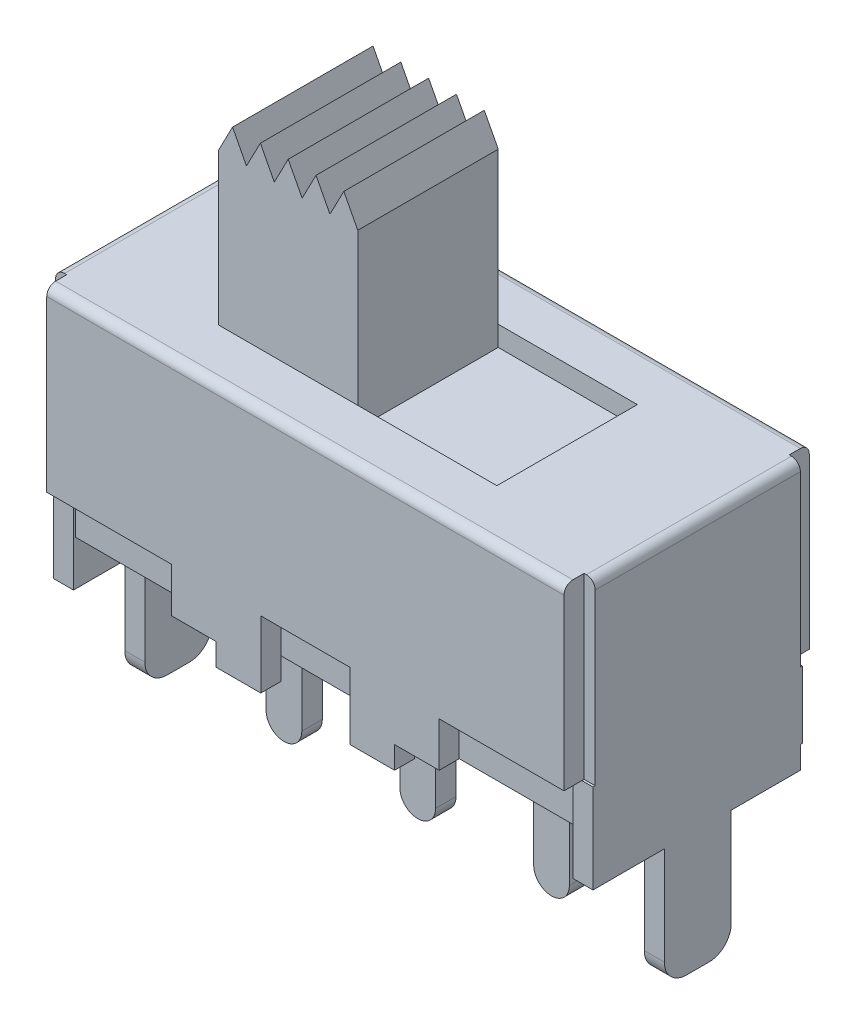
from build123d import *

# Parameters (mm, degrees)
SKETCH_1_W          = 11.2
SKETCH_1_H          = 4.6
EXTRUDE_1_DEPTH     = 5
EXTRUDE_2_DEPTH     = 0.45
EXTRUDE_3_DEPTH     = 0.45
EXTRUDE_4_DEPTH     = 0.45
EXTRUDE_START       = 0.45
EXTRUDE_5_DEPTH     = 0.45
CUT_EXTRUDE_1_DEPTH = 0.45
SKETCH_7_W          = 3.12
SKETCH_7_H          = 3.15
EXTRUDE_6_DEPTH     = 4.45
CUT_EXTRUDE_2_DEPTH = 4.45
EXTRUDE_7_DEPTH     = 3.7
CUT_EXTRUDE_3_DEPTH = 3.7
FILLET_1_R          = 0.2
FILLET_2_R          = 0.2
FILLET_3_R          = 0.2
FILLET_4_R          = 0.2


with BuildPart() as part:
    # 草图1 → 凸台-拉伸1 (new body)
    with BuildSketch(Plane(origin=(0, 0, 0), x_dir=(1, 0, 0), z_dir=(0, 1, 0))):
        with Locations((5.6, 2.3)):
            Rectangle(SKETCH_1_W, SKETCH_1_H)
    extrude(amount=EXTRUDE_1_DEPTH)

    # 草图2 → 凸台-拉伸2 (add)
    with BuildSketch(Plane.XY):
        Polygon((11.4, 5), (11.4, 1), (8.6, 1), (8.6, 0), (7.6, 0), (7.6, -0.5), (6.6, -0.5), (6.6, 1), (5.6, 1), (4.6, 1), (4.6, -0.5), (3.6, -0.5), (3.6, 0), (2.6, 0), (2.6, 1), (-0.2, 1), (-0.2, 5), align=None)
    extrude(amount=EXTRUDE_2_DEPTH)

    # 草图3 → 凸台-拉伸3 (add)
    with BuildSketch(Plane(origin=(0, 0, -4.6), x_dir=(-1, 0, 0), z_dir=(0, 0, -1))):
        Polygon((-5.6, 5), (-11.4, 5), (-11.4, 1), (-8.6, 1), (-8.6, 0), (-7.6, 0), (-7.6, -0.5), (-6.6, -0.5), (-6.6, 1), (-4.6, 1), (-4.6, -0.5), (-3.6, -0.5), (-3.6, 0), (-2.6, 0), (-2.6, 1), (0.2, 1), (0.2, 5), align=None)
    extrude(amount=EXTRUDE_3_DEPTH)

    # 草图4 → 凸台-拉伸4 (add)
    with BuildSketch(Plane(origin=(11.2, 0, 0), x_dir=(0, 0, -1), z_dir=(1, 0, 0))):
        with BuildLine():
            Line((0, 5), (0, 1))
            Line((0, 1), (-0.05, 1))
            Line((-0.05, 1), (-0.05, -1))
            Line((-0.05, -1), (0, -1))
            Line((0, -1), (1.55, -1))
            Line((1.55, -1), (1.55, -3.2))
            ThreePointArc((1.55, -3.2), (1.696446609, -3.553553391), (2.05, -3.7))
            Line((2.05, -3.7), (2.3, -3.7))
            Line((2.3, -3.7), (2.55, -3.7))
            ThreePointArc((2.55, -3.7), (2.903553391, -3.553553391), (3.05, -3.2))
            Line((3.05, -3.2), (3.05, -1))
            Line((3.05, -1), (4.6, -1))
            Line((4.6, -1), (4.6, -0.5))
            Line((4.6, -0.5), (4.65, -0.5))
            Line((4.65, -0.5), (4.65, 1))
            Line((4.65, 1), (4.6, 1))
            Line((4.6, 1), (4.6, 5))
            Line((4.6, 5), (0, 5))
        make_face()
    extrude(amount=EXTRUDE_4_DEPTH)

    # 草图5 → 凸台-拉伸5 (add)
    with BuildSketch(Plane.ZY.offset(EXTRUDE_START)):
        with BuildLine():
            Line((-4.6, 5), (-4.6, 1))
            Line((-4.6, 1), (-4.65, 1))
            Line((-4.65, 1), (-4.65, -1))
            Line((-4.65, -1), (-4.6, -1))
            Line((-4.6, -1), (-3.05, -1))
            Line((-3.05, -1), (-3.05, -3.2))
            ThreePointArc((-3.05, -3.2), (-2.903553391, -3.553553391), (-2.55, -3.7))
            Line((-2.55, -3.7), (-2.05, -3.7))
            ThreePointArc((-2.05, -3.7), (-1.696446609, -3.553553391), (-1.55, -3.2))
            Line((-1.55, -3.2), (-1.55, -1))
            Line((-1.55, -1), (0.05, -1))
            Line((0.05, -1), (0.05, 1))
            Line((0.05, 1), (0, 1))
            Line((0, 1), (0, 5))
            Line((0, 5), (-4.6, 5))
        make_face()
    extrude(amount=-EXTRUDE_5_DEPTH)

    # 草图6 → 切除-拉伸1 (cut)
    with BuildSketch(Plane(origin=(0, 5, 0), x_dir=(1, 0, 0), z_dir=(0, 1, 0))):
        Polygon((2.48, 2.3), (2.48, 3.875), (8.72, 3.875), (8.72, 0.725), (2.48, 0.725), align=None)
    extrude(amount=-CUT_EXTRUDE_1_DEPTH, mode=Mode.SUBTRACT)

    # 草图7 → 凸台-拉伸6 (add)
    with BuildSketch(Plane(origin=(0, 4.55, 0), x_dir=(1, 0, 0), z_dir=(0, 1, 0))):
        with Locations((4.04, 2.3)):
            Rectangle(SKETCH_7_W, SKETCH_7_H)
    extrude(amount=EXTRUDE_6_DEPTH)

    # 草图8 → 切除-拉伸2 (cut)
    with BuildSketch(Plane.XY.offset(-0.725)):
        Polygon((2.48, 8.4), (2.792, 9), (2.48, 9), align=None)
        Polygon((3.104, 8.4), (3.416, 9), (2.792, 9), align=None)
        Polygon((3.728, 8.4), (4.04, 9), (3.416, 9), align=None)
        Polygon((4.352, 8.4), (4.664, 9), (4.04, 9), align=None)
        Polygon((5.288, 9), (4.664, 9), (4.976, 8.4), align=None)
        Polygon((5.6, 9), (5.288, 9), (5.6, 8.4), align=None)
    extrude(amount=-CUT_EXTRUDE_2_DEPTH, mode=Mode.SUBTRACT)

    # 草图9 → 凸台-拉伸7 (add)
    with BuildSketch(Plane.XZ):
        Polygon((8.2, -2.3), (8.2, -2.07), (9, -2.07), (9, -2.3), (9, -2.53), (8.2, -2.53), align=None)
        Polygon((5.2, -2.3), (5.2, -2.07), (6, -2.07), (6, -2.3), (6, -2.53), (5.2, -2.53), align=None)
        Polygon((2.2, -2.3), (2.2, -2.07), (3, -2.07), (3, -2.3), (3, -2.53), (2.2, -2.53), align=None)
    extrude(amount=EXTRUDE_7_DEPTH)

    # 草图10 → 切除-拉伸3 (cut)
    with BuildSketch(Plane.XY.offset(-2.07)):
        with BuildLine():
            ThreePointArc((2.6, -3.7), (2.317157288, -3.582842712), (2.2, -3.3))
            Line((2.2, -3.3), (2.2, -3.7))
            Line((2.2, -3.7), (2.6, -3.7))
        make_face()
        with BuildLine():
            ThreePointArc((3, -3.3), (2.882842712, -3.582842712), (2.6, -3.7))
            Line((2.6, -3.7), (3, -3.7))
            Line((3, -3.7), (3, -3.3))
        make_face()
        with BuildLine():
            Line((3, -3.3), (3, -3.7))
            Line((3, -3.7), (5.6, -3.7))
            ThreePointArc((5.6, -3.7), (5.317157288, -3.582842712), (5.2, -3.3))
            Line((5.2, -3.3), (3, -3.3))
        make_face()
        with BuildLine():
            ThreePointArc((6, -3.3), (5.882842712, -3.582842712), (5.6, -3.7))
            Line((5.6, -3.7), (8.6, -3.7))
            ThreePointArc((8.6, -3.7), (8.317157288, -3.582842712), (8.2, -3.3))
            Line((8.2, -3.3), (6, -3.3))
        make_face()
        with BuildLine():
            ThreePointArc((9, -3.3), (8.882842712, -3.582842712), (8.6, -3.7))
            Line((8.6, -3.7), (9, -3.7))
            Line((9, -3.7), (9, -3.3))
        make_face()
    extrude(amount=-CUT_EXTRUDE_3_DEPTH, mode=Mode.SUBTRACT)

    # 圆角1
    fillet_1_edges = [part.edges().sort_by_distance(p)[0] for p in [
        (-0.45, 5, -2.3),
    ]]
    fillet(fillet_1_edges, radius=FILLET_1_R)

    # 圆角2
    fillet_2_edges = [part.edges().sort_by_distance(p)[0] for p in [
        (5.6, 5, 0.45),
    ]]
    fillet(fillet_2_edges, radius=FILLET_2_R)

    # 圆角3
    fillet_3_edges = [part.edges().sort_by_distance(p)[0] for p in [
        (11.65, 5, -2.3),
    ]]
    fillet(fillet_3_edges, radius=FILLET_3_R)

    # 圆角4
    fillet_4_edges = [part.edges().sort_by_distance(p)[0] for p in [
        (5.6, 5, -5.05),
    ]]
    fillet(fillet_4_edges, radius=FILLET_4_R)


solid = part.part
